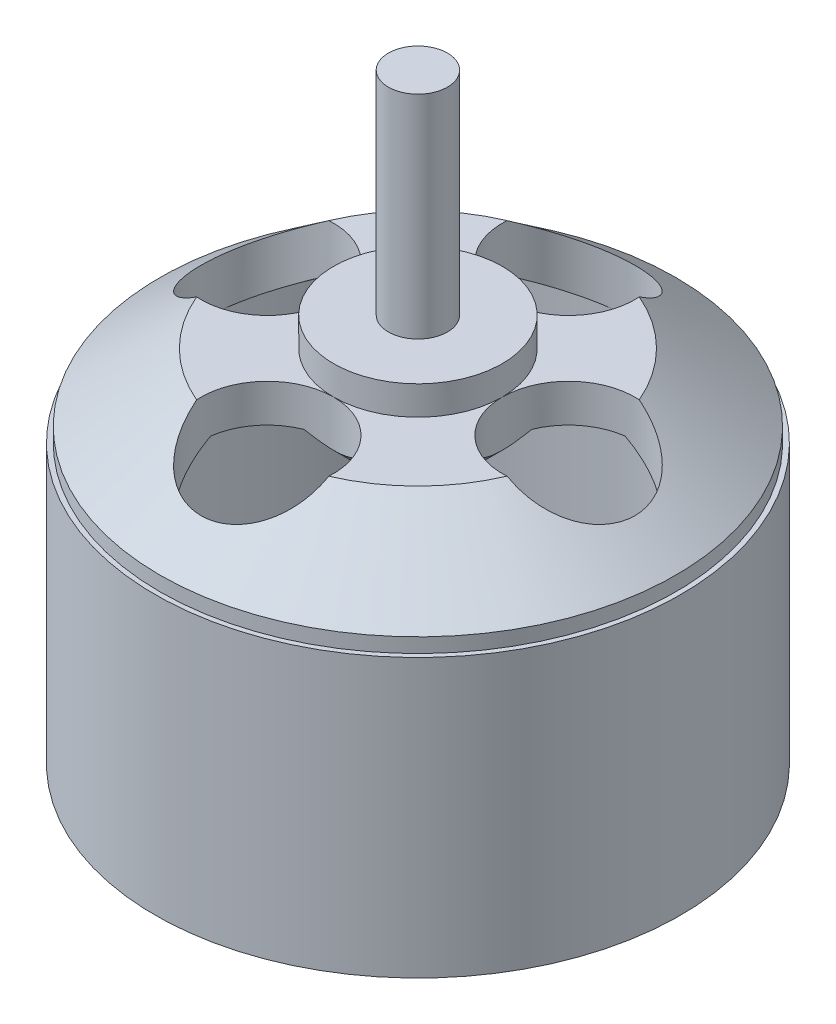
from build123d import *

# Parameters (mm, degrees)
SKETCH3_R          = 13.843
SKETCH3_R_2        = 1.55575
CUT_EXTRUDE2_DEPTH = 38.213955992
SKETCH2_R          = 3.4925
CUT_EXTRUDE1_DEPTH = 5.08


with BuildPart() as part:
    # Sketch1 → Revolve1 (revolve)
    with BuildSketch(Plane.XY, mode=Mode.PRIVATE) as revolve1_sk:
        Polygon((0, 11.176), (1.55575, 11.176), (1.55575, 0), (4.445, 0), (4.445, -1.524), (8.89, -1.524), (13.589, -5.08), (13.589, -5.842), (13.843, -5.842), (13.843, -20.4724), (13.589, -20.4724), (13.589, -23.0124), (12.7, -26.67), (3.81, -26.67), (3.81, -26.924), (1.55575, -26.924), (1.55575, -28.956), (0, -28.956), align=None)
    revolve(revolve1_sk.sketch.rotate(Axis((0, -28.956, 0), (0, 1, 0)), 90), axis=Axis((0, -28.956, 0), (0, 1, 0)))

    # Sketch3 → Cut-Extrude2 (cut, through all)
    with BuildSketch(Plane.XZ.offset(20.4724)):
        with Locations(Location((0, 0, 0), (0, 0, 270))):
            Circle(SKETCH3_R)
        with Locations(Location((0, 0, 0), (0, 0, 270))):
            Circle(SKETCH3_R_2, mode=Mode.SUBTRACT)
    extrude(amount=CUT_EXTRUDE2_DEPTH, mode=Mode.SUBTRACT)

    # Sketch5 → Cut-Revolve1 (revolve, cut)
    with BuildSketch(Plane.XY, mode=Mode.PRIVATE) as cut_revolve1_sk:
        Polygon((11.343, -5.888455731), (11.343, -24.765583443), (1.55575, -24.765583443), (1.55575, -5.842), (2.55575, -5.842), (4.87375, -3.524), (8.218540641, -3.524), align=None)
    revolve(cut_revolve1_sk.sketch.rotate(Axis((0, 11.176, 0), (0, -1, 0)), 90), axis=Axis((0, 11.176, 0), (0, -1, 0)), mode=Mode.SUBTRACT)

    # Sketch2 → Cut-Extrude1 (cut)
    with BuildSketch(Plane(origin=(0, -1.524, 0), x_dir=(1, 0, 0), z_dir=(0, 1, 0))):
        with Locations(Location((0, 7.9375, 0), (0, 0, 270))):
            Circle(SKETCH2_R)
        with Locations(Location((7.9375, 0, 0), (0, 0, 273.961773505))):
            Circle(SKETCH2_R)
        with Locations(Location((0, -7.9375, 0), (0, 0, 90))):
            Circle(SKETCH2_R)
        with Locations(Location((-7.9375, 0, 0), (0, 0, 266.038226276))):
            Circle(SKETCH2_R)
    extrude(amount=-CUT_EXTRUDE1_DEPTH, mode=Mode.SUBTRACT)


solid = part.part
